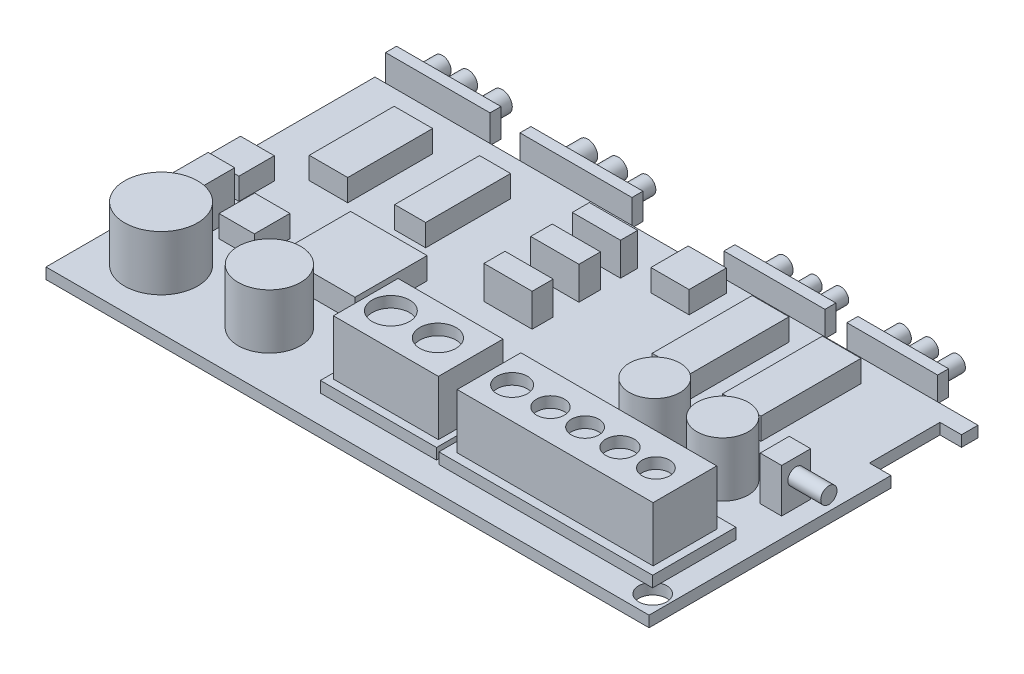
from build123d import *

# Parameters (mm, degrees)
SKETCH1_W            = 55
SKETCH1_H            = 30
BOSS_EXTRUDE1_DEPTH  = 1
SKETCH2_W            = 19.491695939
SKETCH2_H            = 7.592367472
BOSS_EXTRUDE2_DEPTH  = 1
SKETCH3_W            = 17.868683869
SKETCH3_H            = 5.806480893
BOSS_EXTRUDE3_DEPTH  = 5
SKETCH4_R            = 1.387992379
SKETCH4_R_2          = 1.271029941
SKETCH4_R_3          = 1.252160081
SKETCH4_R_4          = 1.29898612
SKETCH4_R_5          = 1.250669325
CUT_EXTRUDE1_DEPTH   = 1
SKETCH5_W            = 10.590314041
SKETCH5_H            = 7.273255242
BOSS_EXTRUDE4_DEPTH  = 1
SKETCH6_W            = 9.57185552
SKETCH6_H            = 5.896073661
BOSS_EXTRUDE5_DEPTH  = 5
SKETCH7_R            = 1.704864166
SKETCH7_R_2          = 1.652773159
CUT_EXTRUDE2_DEPTH   = 1
SKETCH8_W            = 4.39691748
SKETCH8_H            = 1.56078367
SKETCH8_H_2          = 1.965861173
SKETCH8_H_3          = 1.923435972
BOSS_EXTRUDE6_DEPTH  = 3
SKETCH9_W            = 3.511257789
SKETCH9_H            = 7.74384092
SKETCH9_W_2          = 2.828211164
SKETCH9_W_3          = 3.357629357
SKETCH9_H_2          = 9.12002374
SKETCH9_W_4          = 3.515822041
BOSS_EXTRUDE7_DEPTH  = 2
SKETCH11_W           = 9.526847307
SKETCH11_H           = 2.580834009
BOSS_EXTRUDE9_DEPTH  = 1
SKETCH12_W           = 10.214883885
SKETCH12_H           = 2.399198827
BOSS_EXTRUDE10_DEPTH = 1
SKETCH13_W           = 9.211002793
SKETCH13_H           = 2.314821269
BOSS_EXTRUDE11_DEPTH = 1
SKETCH14_W           = 8.269131958
SKETCH14_H           = 2.253083688
BOSS_EXTRUDE12_DEPTH = 1
SKETCH15_R           = 2.31957405
SKETCH15_R_2         = 2.335420551
SKETCH15_R_3         = 2.850653073
SKETCH15_R_4         = 3.324876744
BOSS_EXTRUDE13_DEPTH = 5
SKETCH16_R           = 1.17518149
SKETCH16_R_2         = 1.252285298
SKETCH16_R_3         = 1.321478457
SKETCH16_R_4         = 1.276209415
CUT_EXTRUDE3_DEPTH   = 5
SKETCH17_W           = 3.572088618
SKETCH17_H           = 5.777043793
SKETCH17_W_2         = 3.071926892
SKETCH17_H_2         = 6.434501435
CUT_EXTRUDE4_DEPTH   = 5
SKETCH18_W           = 6.981016606
SKETCH18_H           = 6.578879703
SKETCH18_W_2         = 3.086522126
SKETCH18_H_2         = 3.227214814
SKETCH18_W_3         = 3.221722133
SKETCH18_H_3         = 3.240258565
SKETCH18_W_4         = 3.482439067
SKETCH18_H_4         = 3.404908775
BOSS_EXTRUDE14_DEPTH = 2
SKETCH19_R           = 0.719775063
SKETCH19_R_2         = 0.76029107
SKETCH19_R_3         = 0.758288133
SKETCH19_R_4         = 0.716718546
SKETCH19_R_5         = 0.645890237
SKETCH19_R_6         = 0.78925264
SKETCH19_R_7         = 0.788868737
SKETCH19_R_8         = 0.878549595
SKETCH19_R_9         = 0.90829019
SKETCH19_R_10        = 0.920218082
SKETCH19_R_11        = 0.847809832
SKETCH19_R_12        = 0.813287674
BOSS_EXTRUDE15_DEPTH = 2
SKETCH20_W           = 2.420557599
SKETCH20_H           = 3.478717889
BOSS_EXTRUDE17_DEPTH = 4
SKETCH22_W           = 1.956579844
SKETCH22_H           = 2.647802663
BOSS_EXTRUDE19_DEPTH = 4
SKETCH23_R           = 0.740483371
BOSS_EXTRUDE20_DEPTH = 3


with BuildPart() as part:
    # Sketch1 → Boss-Extrude1 (new body)
    with BuildSketch(Plane(origin=(0, 0, 0), x_dir=(1, 0, 0), z_dir=(0, 1, 0))):
        with Locations((-21.264064322, 3.89729895)):
            Rectangle(SKETCH1_W, SKETCH1_H)
    extrude(amount=BOSS_EXTRUDE1_DEPTH)

    # Sketch2 → Boss-Extrude2 (add)
    with BuildSketch(Plane(origin=(0, 1, 0), x_dir=(1, 0, 0), z_dir=(0, 1, 0))):
        with Locations((-5.49817758, -4.994329297)):
            Rectangle(SKETCH2_W, SKETCH2_H)
    extrude(amount=BOSS_EXTRUDE2_DEPTH)

    # Sketch3 → Boss-Extrude3 (add)
    with BuildSketch(Plane(origin=(0, 2, 0), x_dir=(1, 0, 0), z_dir=(0, 1, 0))):
        with Locations((-5.399712824, -5.130077774)):
            Rectangle(SKETCH3_W, SKETCH3_H)
    extrude(amount=BOSS_EXTRUDE3_DEPTH)

    # Sketch4 → Cut-Extrude1 (cut)
    with BuildSketch(Plane(origin=(0, 7, 0), x_dir=(1, 0, 0), z_dir=(0, 1, 0))):
        with Locations(Location((-12.18713871, -5.16756273, 0), (0, 0, 270))):
            Circle(SKETCH4_R)
        with Locations(Location((-8.689373295, -5.16756273, 0), (0, 0, 270))):
            Circle(SKETCH4_R_2)
        with Locations(Location((-5.533968846, -5.16756273, 0), (0, 0, 270))):
            Circle(SKETCH4_R_3)
        with Locations(Location((-2.349125846, -5.16756273, 0), (0, 0, 270))):
            Circle(SKETCH4_R_4)
        with Locations(Location((0.92403281, -5.16756273, 0), (0, 0, 270))):
            Circle(SKETCH4_R_5)
    extrude(amount=-CUT_EXTRUDE1_DEPTH, mode=Mode.SUBTRACT)

    # Sketch5 → Boss-Extrude4 (add)
    with BuildSketch(Plane(origin=(0, 1, 0), x_dir=(1, 0, 0), z_dir=(0, 1, 0))):
        with Locations((-20.994245653, -4.916719061)):
            Rectangle(SKETCH5_W, SKETCH5_H)
    extrude(amount=BOSS_EXTRUDE4_DEPTH)

    # Sketch6 → Boss-Extrude5 (add)
    with BuildSketch(Plane(origin=(0, 2, 0), x_dir=(1, 0, 0), z_dir=(0, 1, 0))):
        with Locations((-21.014512422, -4.903762727)):
            Rectangle(SKETCH6_W, SKETCH6_H)
    extrude(amount=BOSS_EXTRUDE5_DEPTH)

    # Sketch7 → Cut-Extrude2 (cut)
    with BuildSketch(Plane(origin=(0, 7, 0), x_dir=(1, 0, 0), z_dir=(0, 1, 0))):
        with Locations(Location((-23.578627502, -4.834787204, 0), (0, 0, 270))):
            Circle(SKETCH7_R)
        with Locations(Location((-19.287367013, -4.834787204, 0), (0, 0, 270))):
            Circle(SKETCH7_R_2)
    extrude(amount=-CUT_EXTRUDE2_DEPTH, mode=Mode.SUBTRACT)

    # Sketch8 → Boss-Extrude6 (add)
    with BuildSketch(Plane(origin=(0, 1, 0), x_dir=(1, 0, 0), z_dir=(0, 1, 0))):
        with Locations((-23.873740649, 14.984908312)):
            Rectangle(SKETCH8_W, SKETCH8_H)
        with Locations((-23.873740649, 11.393249572)):
            Rectangle(SKETCH8_W, SKETCH8_H_2)
        with Locations((-23.873740649, 7.106266144)):
            Rectangle(SKETCH8_W, SKETCH8_H_3)
    extrude(amount=BOSS_EXTRUDE6_DEPTH)

    # Sketch9 → Boss-Extrude7 (add)
    with BuildSketch(Plane(origin=(0, 1, 0), x_dir=(1, 0, 0), z_dir=(0, 1, 0))):
        with Locations((-41.824470852, 11.59406106)):
            Rectangle(SKETCH9_W, SKETCH9_H)
        with Locations((-34.376000541, 11.59406106)):
            Rectangle(SKETCH9_W_2, SKETCH9_H)
        with Locations((-10.62597461, 12.28215247)):
            Rectangle(SKETCH9_W_3, SKETCH9_H_2)
        with Locations((-4.140862927, 12.28215247)):
            Rectangle(SKETCH9_W_4, SKETCH9_H_2)
    extrude(amount=BOSS_EXTRUDE7_DEPTH)

    # Sketch11 → Boss-Extrude9 (add)
    with BuildSketch(Plane(origin=(0, 0, -18.89729895), x_dir=(-1, 0, 0), z_dir=(0, 0, -1))):
        with Locations((43.030759371, 2.129646377)):
            Rectangle(SKETCH11_W, SKETCH11_H)
    extrude(amount=BOSS_EXTRUDE9_DEPTH)

    # Sketch12 → Boss-Extrude10 (add)
    with BuildSketch(Plane(origin=(0, 0, -18.89729895), x_dir=(-1, 0, 0), z_dir=(0, 0, -1))):
        with Locations((30.43046596, 2.006084235)):
            Rectangle(SKETCH12_W, SKETCH12_H)
    extrude(amount=BOSS_EXTRUDE10_DEPTH)

    # Sketch13 → Boss-Extrude11 (add)
    with BuildSketch(Plane(origin=(0, 0, -18.89729895), x_dir=(-1, 0, 0), z_dir=(0, 0, -1))):
        with Locations((12.330175076, 2.015979145)):
            Rectangle(SKETCH13_W, SKETCH13_H)
    extrude(amount=BOSS_EXTRUDE11_DEPTH)

    # Sketch14 → Boss-Extrude12 (add)
    with BuildSketch(Plane(origin=(0, 0, -18.89729895), x_dir=(-1, 0, 0), z_dir=(0, 0, -1))):
        with Locations((1.581311109, 1.994768123)):
            Rectangle(SKETCH14_W, SKETCH14_H)
    extrude(amount=BOSS_EXTRUDE12_DEPTH)

    # Sketch15 → Boss-Extrude13 (add)
    with BuildSketch(Plane(origin=(0, 1, 0), x_dir=(1, 0, 0), z_dir=(0, 1, 0))):
        with Locations(Location((-7.252523926, 2.900653957, 0), (0, 0, 270))):
            Circle(SKETCH15_R)
        with Locations(Location((-1.058148133, 2.900653957, 0), (0, 0, 270))):
            Circle(SKETCH15_R_2)
        with Locations(Location((-33.782017374, -5.710655696, 0), (0, 0, 270))):
            Circle(SKETCH15_R_3)
        with Locations(Location((-43.660307349, -5.710655696, 0), (0, 0, 270))):
            Circle(SKETCH15_R_4)
    extrude(amount=BOSS_EXTRUDE13_DEPTH)

    # Sketch16 → Cut-Extrude3 (cut)
    with BuildSketch(Plane(origin=(0, 1, 0), x_dir=(1, 0, 0), z_dir=(0, 1, 0))):
        with Locations((-51.576522497, 22.016727671)):
            Circle(SKETCH16_R)
        with Locations((-51.576522497, -8.848199257)):
            Circle(SKETCH16_R_2)
        with Locations((4.236348916, 22.016727671)):
            Circle(SKETCH16_R_3)
        with Locations(Location((4.71641652, -9.248882224, 0), (0, 0, 270))):
            Circle(SKETCH16_R_4)
    extrude(amount=-CUT_EXTRUDE3_DEPTH, mode=Mode.SUBTRACT)

    # Sketch17 → Cut-Extrude4 (cut)
    with BuildSketch(Plane(origin=(0, 1, 0), x_dir=(1, 0, 0), z_dir=(0, 1, 0))):
        with Locations((-52.185475992, 15.830959354)):
            Rectangle(SKETCH17_W, SKETCH17_H)
        with Locations((5.809579957, 14.174599881)):
            Rectangle(SKETCH17_W_2, SKETCH17_H_2)
    extrude(amount=-CUT_EXTRUDE4_DEPTH, mode=Mode.SUBTRACT)

    # Sketch18 → Boss-Extrude14 (add)
    with BuildSketch(Plane(origin=(0, 1, 0), x_dir=(1, 0, 0), z_dir=(0, 1, 0))):
        with Locations((-33.773534226, 1.886893529)):
            Rectangle(SKETCH18_W, SKETCH18_H)
        with Locations((-46.681665239, 4.480707082)):
            Rectangle(SKETCH18_W_2, SKETCH18_H_2)
        with Locations((-41.483525563, 0.631278088)):
            Rectangle(SKETCH18_W_3, SKETCH18_H_3)
        with Locations((-17.396903315, 16.139817099)):
            Rectangle(SKETCH18_W_4, SKETCH18_H_4)
    extrude(amount=BOSS_EXTRUDE14_DEPTH)

    # Sketch19 → Boss-Extrude15 (add)
    with BuildSketch(Plane(origin=(0, 0, -19.89729895), x_dir=(-1, 0, 0), z_dir=(0, 0, -1))):
        with Locations((-1.366958386, 1.973684487)):
            Circle(SKETCH19_R)
        with Locations((1.106822062, 1.973684487)):
            Circle(SKETCH19_R_2)
        with Locations((3.600495928, 1.795519179)):
            Circle(SKETCH19_R_3)
        with Locations((9.279826449, 1.973684487)):
            Circle(SKETCH19_R_4)
        with Locations((11.619345424, 1.795519179)):
            Circle(SKETCH19_R_5)
        with Locations((14.413821044, 1.795519179)):
            Circle(SKETCH19_R_6)
        with Locations((26.935713498, 1.898398295)):
            Circle(SKETCH19_R_7)
        with Locations((29.585968295, 1.898398295)):
            Circle(SKETCH19_R_8)
        with Locations((32.353085369, 1.898398295)):
            Circle(SKETCH19_R_9)
        with Locations((40.159649939, 1.898398295)):
            Circle(SKETCH19_R_10)
        with Locations((43.252965878, 1.973684487)):
            Circle(SKETCH19_R_11)
        with Locations((45.626690014, 1.973684487)):
            Circle(SKETCH19_R_12)
    extrude(amount=BOSS_EXTRUDE15_DEPTH)

    # Sketch20 → Boss-Extrude17 (add)
    with BuildSketch(Plane(origin=(0, 1, 0), x_dir=(1, 0, 0), z_dir=(0, 1, 0))):
        with Locations((-45.209433873, -0.39597322)):
            Rectangle(SKETCH20_W, SKETCH20_H)
    extrude(amount=BOSS_EXTRUDE17_DEPTH)

    # Sketch22 → Boss-Extrude19 (add)
    with BuildSketch(Plane(origin=(0, 1, 0), x_dir=(1, 0, 0), z_dir=(0, 1, 0))):
        with Locations((3.480988959, 4.090806431)):
            Rectangle(SKETCH22_W, SKETCH22_H)
    extrude(amount=BOSS_EXTRUDE19_DEPTH)

    # Sketch23 → Boss-Extrude20 (add)
    with BuildSketch(Plane(origin=(4.459278881, 0, 0), x_dir=(0, 0, -1), z_dir=(1, 0, 0))):
        with Locations(Location((4.071876489, 3.501691713, 0), (0, 0, 180))):
            Circle(SKETCH23_R)
    extrude(amount=BOSS_EXTRUDE20_DEPTH)


solid = part.part
